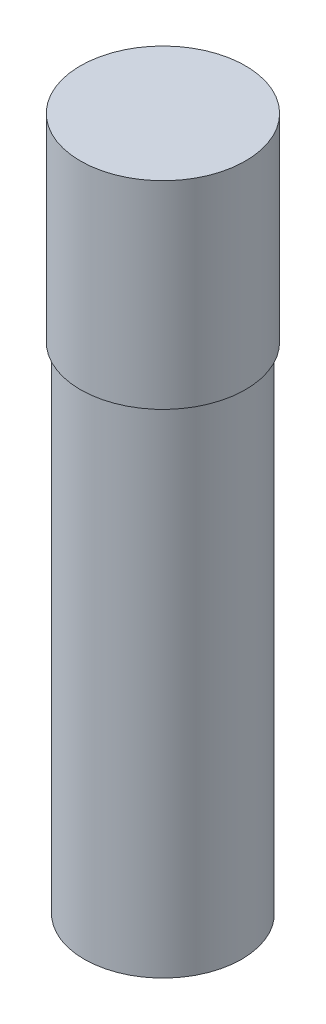
from build123d import *

# Parameters (mm, degrees)
CROQUIS2_R              = 4.775
SALIENTE_EXTRUIR1_DEPTH = 30
CROQUIS3_R              = 5
SALIENTE_EXTRUIR2_DEPTH = 12


with BuildPart() as part:
    # Croquis2 → Saliente-Extruir1 (new body)
    with BuildSketch(Plane(origin=(0, 0, 0), x_dir=(1, 0, 0), z_dir=(0, 1, 0))):
        with Locations(Location((0, 0, 0), (0, 0, 270))):
            Circle(CROQUIS2_R)
    extrude(amount=SALIENTE_EXTRUIR1_DEPTH)

    # Croquis3 → Saliente-Extruir2 (add)
    with BuildSketch(Plane(origin=(0, 30, 0), x_dir=(1, 0, 0), z_dir=(0, 1, 0))):
        with Locations(Location((0, 0, 0), (0, 0, 270))):
            Circle(CROQUIS3_R)
    extrude(amount=SALIENTE_EXTRUIR2_DEPTH)


solid = part.part
